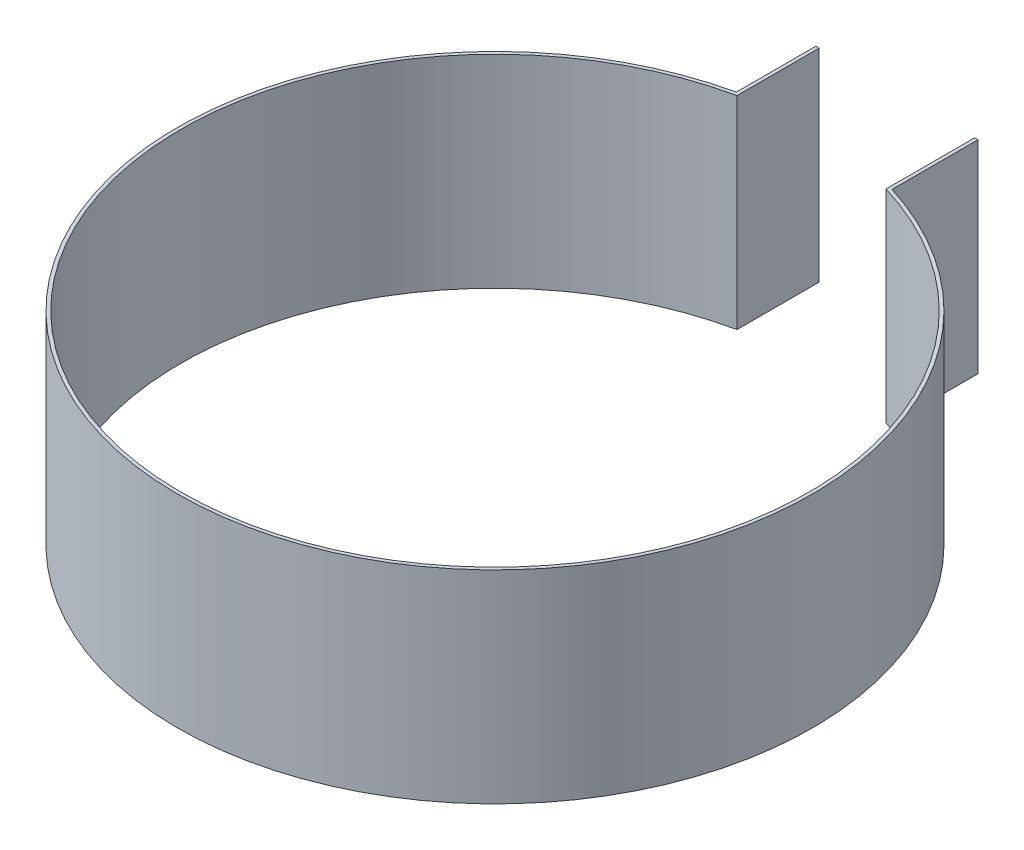
from build123d import *

# Parameters (mm, degrees)
SKETCH1_R               = 47
BOSS_EXTRUDE1_DEPTH     = 30
SKETCH3_W               = 24
SKETCH3_H               = 15
BOSS_EXTRUDE2_DEPTH     = 30
SKETCH4_W               = 24
SKETCH4_H               = 15
CUT_EXTRUDE1_DEPTH      = 30
CUT_EXTRUDE2_DEPTH      = 81.211785557
CUT_EXTRUDE2_DEPTH_BACK = 30
SKETCH6_R               = 46.5
CUT_EXTRUDE3_DEPTH      = 30
SKETCH9_W               = 4.550783746
SKETCH9_H               = 30
CUT_EXTRUDE4_DEPTH      = 30
SKETCH10_W              = 0.875085896
SKETCH10_H              = 30
CUT_EXTRUDE5_DEPTH      = 30


with BuildPart() as part:
    # Sketch1 → Boss-Extrude1 (new body)
    with BuildSketch(Plane(origin=(0, 0, 0), x_dir=(1, 0, 0), z_dir=(0, 1, 0))):
        with Locations(Location((0, 0, 0), (0, 0, 270))):
            Circle(SKETCH1_R)
    extrude(amount=BOSS_EXTRUDE1_DEPTH)

    # Sketch3 → Boss-Extrude2 (add, symmetric)
    with BuildSketch(Plane(origin=(0, 30, 0), x_dir=(1, 0, 0), z_dir=(0, 1, 0))):
        with Locations((1.837848925, 50.162210695)):
            Rectangle(SKETCH3_W, SKETCH3_H)
    extrude(amount=BOSS_EXTRUDE2_DEPTH, both=True)

    # Sketch4 → Cut-Extrude1 (cut)
    with BuildSketch(Plane(origin=(0, 60, 0), x_dir=(1, 0, 0), z_dir=(0, 1, 0))):
        with Locations((1.837848925, 50.162210695)):
            Rectangle(SKETCH4_W, SKETCH4_H)
    extrude(amount=-CUT_EXTRUDE1_DEPTH, mode=Mode.SUBTRACT)

    # Sketch5 → Cut-Extrude2 (cut, two sides: drawn at the far end of the back side and taken through both)
    with BuildSketch(Plane(origin=(0, 30, 0), x_dir=(1, 0, 0), z_dir=(0, 1, 0)).offset(-CUT_EXTRUDE2_DEPTH_BACK)):
        Polygon((-9.036385525, 57.662210695), (-9.662151075, 57.662210695), (-9.662151075, 45.662210695), (13.337848925, 45.662210695), (13.337848925, 57.662210695), align=None)
    extrude(amount=CUT_EXTRUDE2_DEPTH + CUT_EXTRUDE2_DEPTH_BACK, mode=Mode.SUBTRACT)

    # Sketch6 → Cut-Extrude3 (cut)
    with BuildSketch(Plane(origin=(0, 30, 0), x_dir=(1, 0, 0), z_dir=(0, 1, 0))):
        Circle(SKETCH6_R)
    extrude(amount=-CUT_EXTRUDE3_DEPTH, mode=Mode.SUBTRACT)

    # Sketch9 → Cut-Extrude4 (cut)
    with BuildSketch(Plane(origin=(0, 0, -45.662210695), x_dir=(-1, 0, 0), z_dir=(0, 0, -1))):
        with Locations((-11.062457052, 15)):
            Rectangle(SKETCH9_W, SKETCH9_H)
    extrude(amount=-CUT_EXTRUDE4_DEPTH, mode=Mode.SUBTRACT)

    # Sketch10 → Cut-Extrude5 (cut)
    with BuildSketch(Plane(origin=(0, 0, -45.662210695), x_dir=(-1, 0, 0), z_dir=(0, 0, -1))):
        with Locations((9.224608127, 15)):
            Rectangle(SKETCH10_W, SKETCH10_H)
    extrude(amount=-CUT_EXTRUDE5_DEPTH, mode=Mode.SUBTRACT)


solid = part.part
